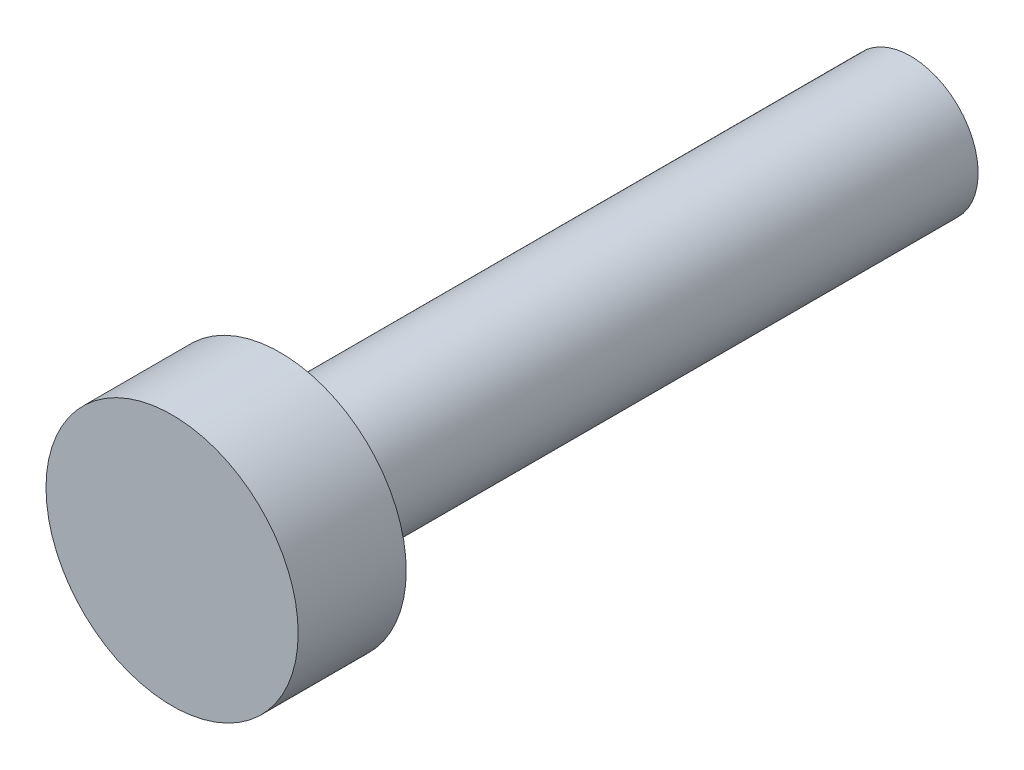
from build123d import *

# Parameters (mm, degrees)
ESQUISSE1_R        = 2.8
BOSS_EXTRU_1_DEPTH = 2.4
ESQUISSE2_R        = 1.5
BOSS_EXTRU_2_DEPTH = 14


with BuildPart() as part:
    # Esquisse1 → Boss.-Extru.1 (new body)
    with BuildSketch(Plane.XY):
        Circle(ESQUISSE1_R)
    extrude(amount=BOSS_EXTRU_1_DEPTH)

    # Esquisse2 → Boss.-Extru.2 (add)
    with BuildSketch(Plane(origin=(0, 0, 0), x_dir=(-1, 0, 0), z_dir=(0, 0, -1))):
        Circle(ESQUISSE2_R)
    extrude(amount=BOSS_EXTRU_2_DEPTH)


solid = part.part
